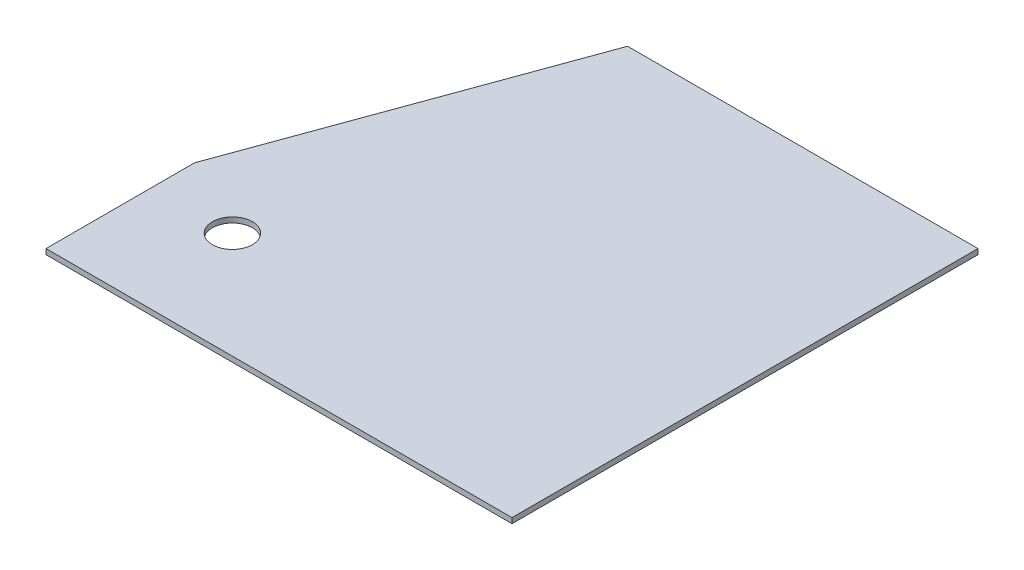
from build123d import *

# Parameters (mm, degrees)
BOSS_EXTRUDE1_DEPTH = 2
SKETCH2_R           = 7.5
CUT_EXTRUDE1_DEPTH  = 10


with BuildPart() as part:
    # Sketch1 → Boss-Extrude1 (new body)
    with BuildSketch(Plane(origin=(0, 0, 0), x_dir=(1, 0, 0), z_dir=(0, 1, 0))):
        Polygon((-175, 55.76), (-131.59, 175), (0, 175), (0, 0), (-175, 0), align=None)
    extrude(amount=BOSS_EXTRUDE1_DEPTH)

    # Sketch2 → Cut-Extrude1 (cut)
    with BuildSketch(Plane.XZ):
        with Locations(Location((-145, -40, 0), (0, 0, 270))):
            Circle(SKETCH2_R)
    extrude(amount=-CUT_EXTRUDE1_DEPTH, mode=Mode.SUBTRACT)


solid = part.part
